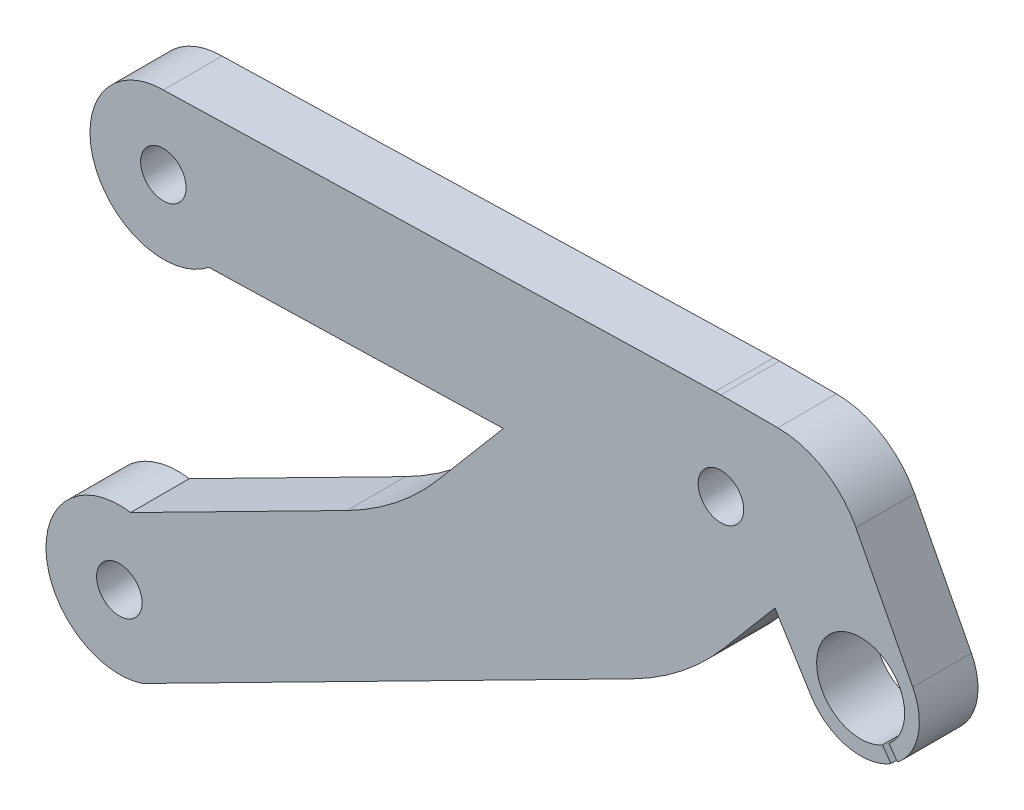
from build123d import *

# Parameters (mm, degrees)
BOSS_EXTRUDE1_DEPTH      = 2
BOSS_EXTRUDE1_DEPTH_BACK = 2
SKETCH2_R                = 1.55
FILLET1_R                = 20
BOSS_EXTRUDE3_START      = -4
BOSS_EXTRUDE3_DEPTH      = 4
FILLET3_R                = 6


with BuildPart() as part:
    # Sketch2 → Boss-Extrude1 (new, two sides: drawn at the far end of the back side and taken through both)
    with BuildSketch(Plane.XY.offset(-BOSS_EXTRUDE1_DEPTH_BACK)):
        with BuildLine():
            Line((1.575752274, -4.745208612), (38.598254294, 14.069940073))
            Line((38.598254294, 14.069940073), (44.683748534, 21.26396825))
            ThreePointArc((44.683748534, 21.26396825), (46.605489471, 28.139740122), (40.590896347, 31.986036602))
            Line((40.590896347, 31.986036602), (3, 31))
            ThreePointArc((3, 31), (-1.722747684, 24.35815521), (6.101607472, 22.078261726))
            Line((6.101607472, 22.078261726), (26.170960727, 22.604695486))
            Line((26.170960727, 22.604695486), (19.115779569, 14.264342174))
            Line((19.115779569, 14.264342174), (0.76923556, 4.940473323))
            ThreePointArc((0.76923556, 4.940473323), (-4.982755324, -0.41490888), (1.575752274, -4.745208612))
        make_face()
        Circle(SKETCH2_R, mode=Mode.SUBTRACT)
        with Locations((41, 26)):
            Circle(SKETCH2_R, mode=Mode.SUBTRACT)
        with Locations((3, 26)):
            Circle(SKETCH2_R, mode=Mode.SUBTRACT)
    extrude(amount=BOSS_EXTRUDE1_DEPTH + BOSS_EXTRUDE1_DEPTH_BACK)

    # Fillet1
    fillet1_edges = [part.edges().sort_by_distance(p)[0] for p in [
        (38.598254294, 14.069940073, 0),
        (19.115779569, 14.264342174, 0),
    ]]
    fillet(fillet1_edges, radius=FILLET1_R)

    # Sketch4 → Boss-Extrude3 (add)
    with BuildSketch(Plane.XY.offset(2).offset(BOSS_EXTRUDE3_START)):
        with BuildLine():
            Line((44.683748534, 21.26396825), (47.128315366, 17.33721301))
            ThreePointArc((47.128315366, 17.33721301), (49.590140611, 15.561753741), (52.589716544, 16.025847893))
            Line((52.589716544, 16.025847893), (52.014355474, 16.847548658))
            ThreePointArc((52.014355474, 16.847548658), (48.803326553, 21.908657431), (52.460976548, 17.160276102))
            Line((52.460976548, 17.160276102), (53.036337618, 16.338575336))
            ThreePointArc((53.036337618, 16.338575336), (54.438800344, 18.629754015), (54.07561509, 21.291426028))
            Line((54.07561509, 21.291426028), (48.52701486, 31.999999837))
            Line((48.52701486, 31.999999837), (41.001398133, 31.999999837))
            ThreePointArc((41.001398133, 31.999999837), (46.67544448, 27.946620135), (44.683748534, 21.26396825))
        make_face()
    extrude(amount=BOSS_EXTRUDE3_DEPTH)

    # Fillet3
    fillet3_edges = [part.edges().sort_by_distance(p)[0] for p in [
        (48.52701486, 31.999999837, 0),
    ]]
    fillet(fillet3_edges, radius=FILLET3_R)


solid = part.part
